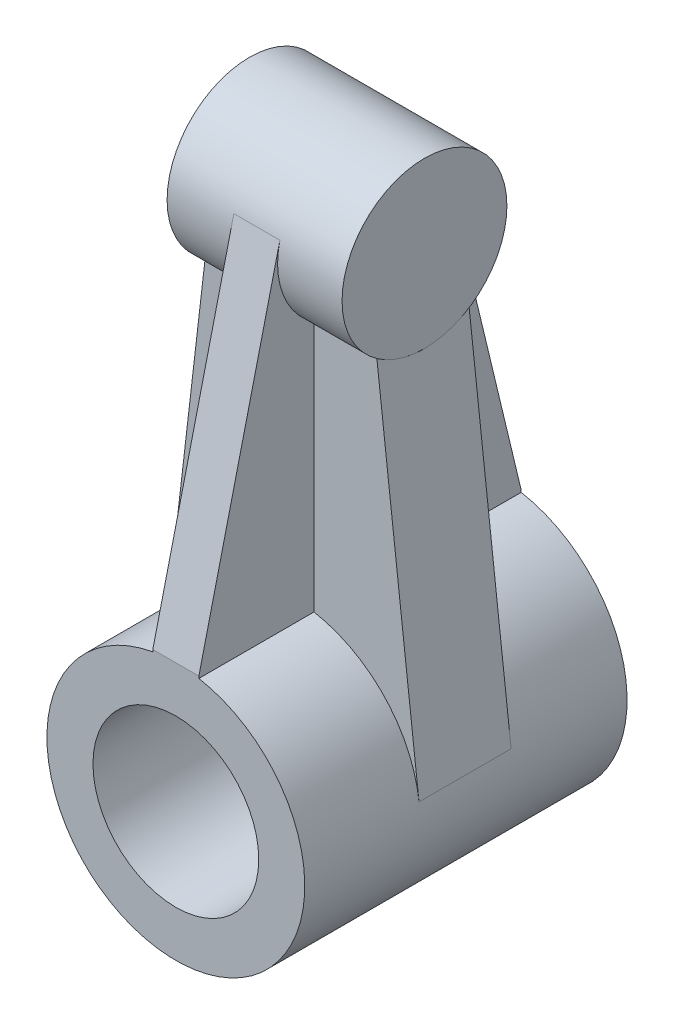
from build123d import *

# Parameters (mm, degrees)
SKETCH1_R           = 14
SKETCH1_R_2         = 9
BOSS_EXTRUDE1_DEPTH = 35
SKETCH3_R           = 8.950574332
BOSS_EXTRUDE2_DEPTH = 9.5
BOSS_EXTRUDE3_DEPTH = 2.5
SKETCH7_W           = 5
SKETCH7_H           = 35
BOSS_EXTRUDE5_DEPTH = 0.225023
RIB12_REACH         = 63.664
SKETCH6_WALL_W      = 163.51256394
SKETCH6_WALL_H      = 10


with BuildPart() as part:
    # Sketch1 → Boss-Extrude1 (new body)
    with BuildSketch(Plane.XY):
        Circle(SKETCH1_R)
        Circle(SKETCH1_R_2, mode=Mode.SUBTRACT)
    extrude(amount=BOSS_EXTRUDE1_DEPTH)



with BuildPart() as body_2:
    # Sketch3 → Boss-Extrude2 (new, symmetric)
    with BuildSketch(Plane(origin=(0, 0, 0), x_dir=(0, 0, -1), z_dir=(1, 0, 0))):
        with Locations((-17.5, 48.496368985)):
            Circle(SKETCH3_R)
    extrude(amount=BOSS_EXTRUDE2_DEPTH, both=True)

    # Sketch3<3> → Boss-Extrude3 (add, symmetric)
    with BuildSketch(Plane(origin=(0, 0, 0), x_dir=(0, 0, -1), z_dir=(1, 0, 0))):
        with BuildLine():
            Line((-26.202553454, 50.588818327), (-35, 14))
            Line((-35, 14), (0, 14))
            Line((0, 14), (-8.797446546, 50.588818327))
            ThreePointArc((-8.797446546, 50.588818327), (-8.61164716, 49.549917585), (-8.549425668, 48.496368985))
            ThreePointArc((-8.549425668, 48.496368985), (-18.553548599, 39.608016145), (-26.202553454, 50.588818327))
        make_face()
    extrude(amount=BOSS_EXTRUDE3_DEPTH, both=True)


with BuildPart() as part_1:
    add(part.part)

    add(body_2.part)  # Boss-Extrude5 merges body 2
    # Sketch7 → Boss-Extrude5 (add)
    with BuildSketch(Plane.XZ.offset(-14)):
        with Locations((0, 17.5)):
            Rectangle(SKETCH7_W, SKETCH7_H)
    extrude(amount=BOSS_EXTRUDE5_DEPTH)

    # Sketch6 wall → Rib12 (add, up to next)
    with BuildSketch(Plane(origin=(11.703236177, 20.580676171, 17.5), x_dir=(0.115396977809, -0.993319453908, 0), z_dir=(-0.993319453908, -0.115396977809, 0)), mode=Mode.PRIVATE) as rib12_sk1:
        Rectangle(SKETCH6_WALL_W, SKETCH6_WALL_H)
    rib12_tool1 = extrude(rib12_sk1.sketch, amount=RIB12_REACH, mode=Mode.PRIVATE) - part_1.part
    rib12 = rib12_tool1.solids().sort_by_distance((11.703236177, 20.580676171, 17.5))[0]
    add(rib12)

    # Mirror1: Rib12 across plane
    add(rib12.mirror(Plane(origin=(0, 0, 0), x_dir=(0, 0, 1), z_dir=(1, 0, 0))))


solid = part_1.part
